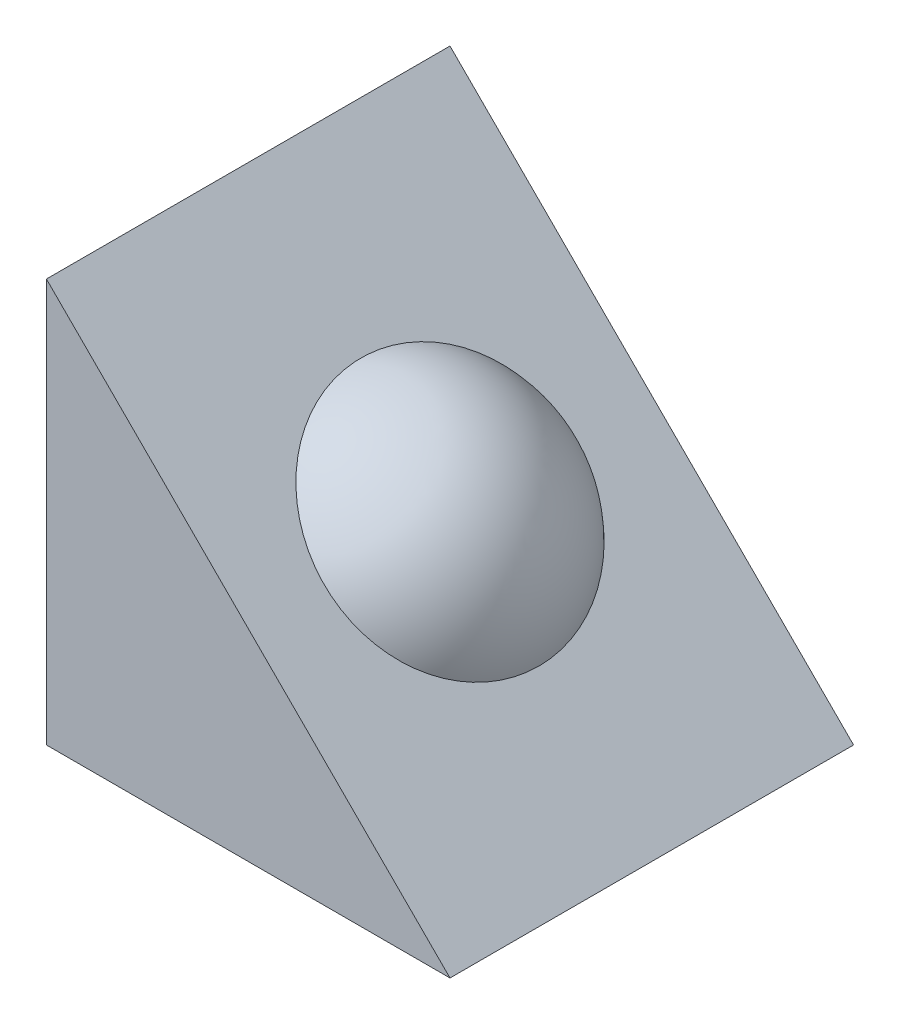
from build123d import *
from build123d.topology import SkipClean

# Parameters (mm, degrees)
BOSS_EXTRUDE1_DEPTH = 25


with BuildPart() as part:
    # Sketch1 → Boss-Extrude1 (new, symmetric)
    with BuildSketch(Plane.XY):
        Polygon((0, 50), (0, 0), (50, 0), align=None)
    extrude(amount=BOSS_EXTRUDE1_DEPTH, both=True)

    # Sketch2 → Revolve1 (revolve)
    with SkipClean():  # the faces are left unmerged after this step: merging them gives an invalid solid
        with BuildSketch(Plane.XY):
            with BuildLine():
                Line((5.908116908, 31.363961031), (31.363961031, 5.908116908))
                ThreePointArc((31.363961031, 5.908116908), (31.363961031, 31.363961031), (5.908116908, 31.363961031))
            make_face()
        revolve(axis=Axis((5.908116908, 31.363961031, 0), (0.7071067811865475, -0.7071067811865476, 0)))


solid = part.part
